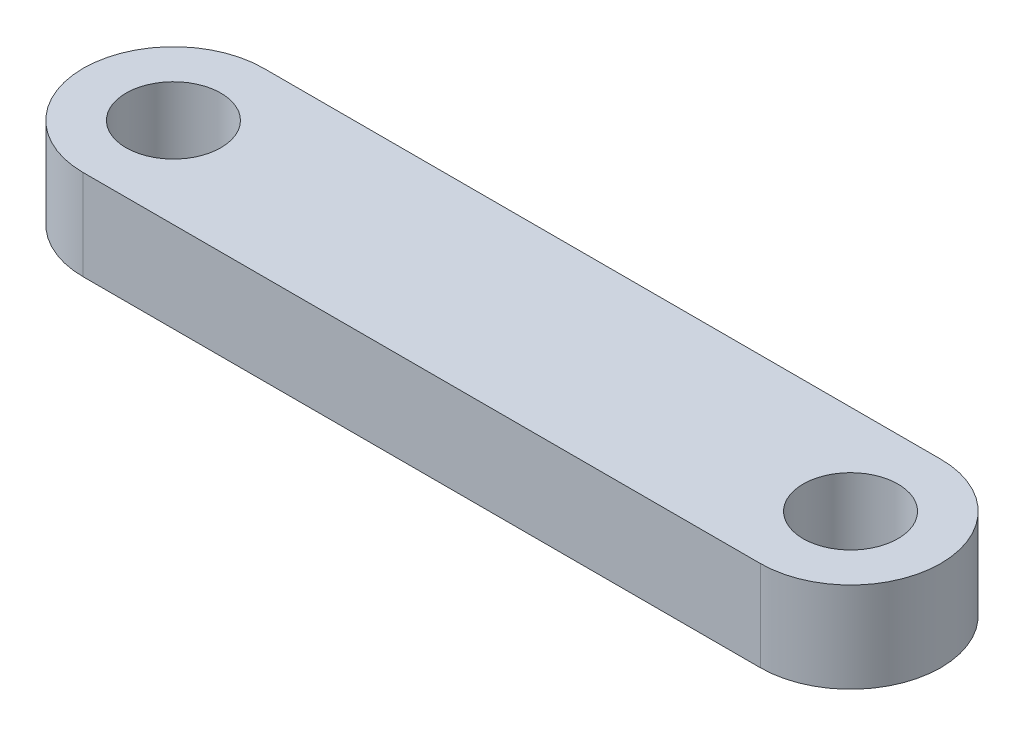
from build123d import *

# Parameters (mm, degrees)
SKETCH1_R           = 1.05
BOSS_EXTRUDE1_DEPTH = 2


with BuildPart() as part:
    # Sketch1 → Boss-Extrude1 (new body)
    with BuildSketch(Plane(origin=(0, 0, 0), x_dir=(1, 0, 0), z_dir=(0, 1, 0))):
        with BuildLine():
            Line((0, 2), (15, 2))
            ThreePointArc((15, 2), (17, 0), (15, -2))
            Line((15, -2), (0, -2))
            ThreePointArc((0, -2), (-2, 0), (0, 2))
        make_face()
        with Locations(Location((0, 0, 0), (0, 0, 270))):
            Circle(SKETCH1_R, mode=Mode.SUBTRACT)
        with Locations(Location((15, 0, 0), (0, 0, 270))):
            Circle(SKETCH1_R, mode=Mode.SUBTRACT)
    extrude(amount=BOSS_EXTRUDE1_DEPTH)


solid = part.part
